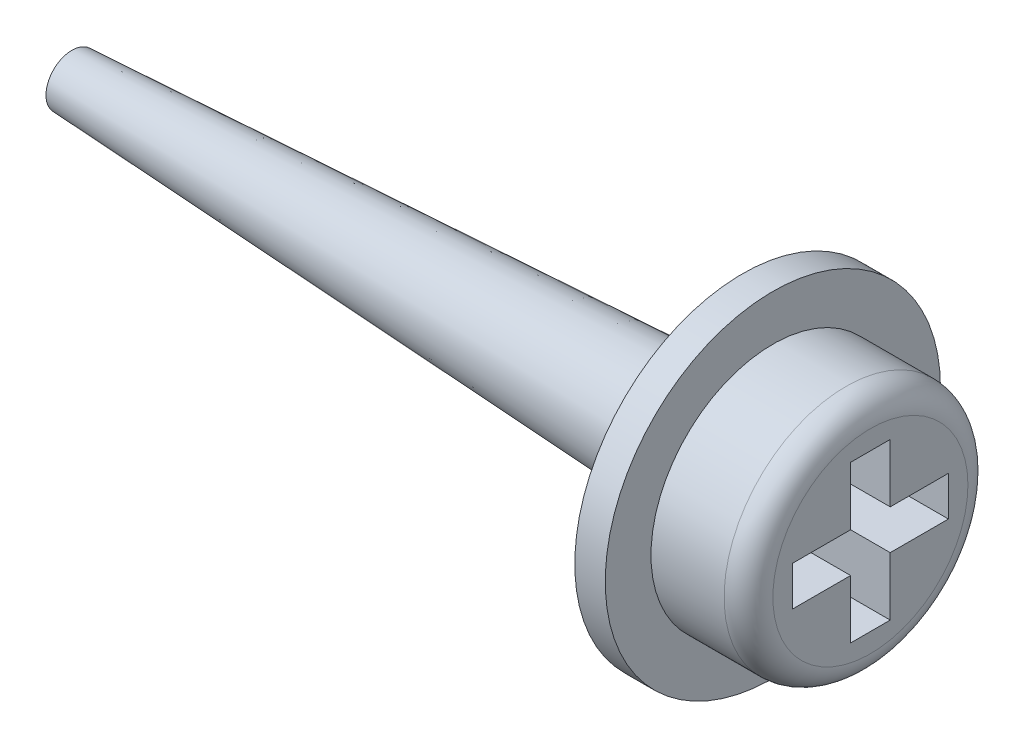
from build123d import *

# Parameters (mm, degrees)
ESQUISSE5_R             = 3.3
BOSS_EXTRU_3_DEPTH      = 0.6
ESQUISSE6_R             = 2.4
BOSS_EXTRU_4_DEPTH      = 1.92
ENL_V_MAT_EXTRU_2_DEPTH = 1.92
CONG_2_R                = 0.36
CONG_3_R                = 0.48


with BuildPart() as part:
    # Esquisse4 → Révolution2 (revolve)
    with BuildSketch(Plane.XY, mode=Mode.PRIVATE) as r_volution2_sk:
        Polygon((10.181803279, 0), (-3.018196721, 0), (-3.018196721, -0.51), (10.181803279, -1.2), align=None)
    revolve(r_volution2_sk.sketch.rotate(Axis((-3.018196721, 0, 0), (1, 0, 0)), 270), axis=Axis((-3.018196721, 0, 0), (1, 0, 0)))

    # Esquisse5 → Boss.-Extru.3 (add)
    with BuildSketch(Plane(origin=(10.181803279, 0, 0), x_dir=(0, 0, -1), z_dir=(1, 0, 0))):
        Circle(ESQUISSE5_R)
    extrude(amount=BOSS_EXTRU_3_DEPTH)

    # Esquisse6 → Boss.-Extru.4 (add)
    with BuildSketch(Plane(origin=(10.781803279, 0, 0), x_dir=(0, 0, -1), z_dir=(1, 0, 0))):
        Circle(ESQUISSE6_R)
    extrude(amount=BOSS_EXTRU_4_DEPTH)

    # Esquisse7 → Enlèv. mat.-Extru.2 (cut)
    with BuildSketch(Plane(origin=(12.701803279, 0, 0), x_dir=(0, 0, -1), z_dir=(1, 0, 0))):
        Polygon((-0.39, 1.54), (0.39, 1.54), (0.39, 0.39), (1.536, 0.39), (1.536, -0.39), (0.39, -0.39), (0.39, -1.54), (-0.39, -1.54), (-0.39, -0.39), (-1.536, -0.39), (-1.536, 0.39), (-0.39, 0.39), align=None)
    extrude(amount=-ENL_V_MAT_EXTRU_2_DEPTH, mode=Mode.SUBTRACT)

    # Congé2
    cong_2_edges = [part.edges().sort_by_distance(p)[0] for p in [
        (10.781803279, -1.54, 0),
        (10.781803279, 0, 1.536),
        (10.781803279, 1.54, 0),
        (10.781803279, 0, -1.536),
    ]]
    fillet(cong_2_edges, radius=CONG_2_R)

    # Congé3
    cong_3_edges = [part.edges().sort_by_distance(p)[0] for p in [
        (12.701803279, 0, 2.4),
    ]]
    fillet(cong_3_edges, radius=CONG_3_R)


solid = part.part
